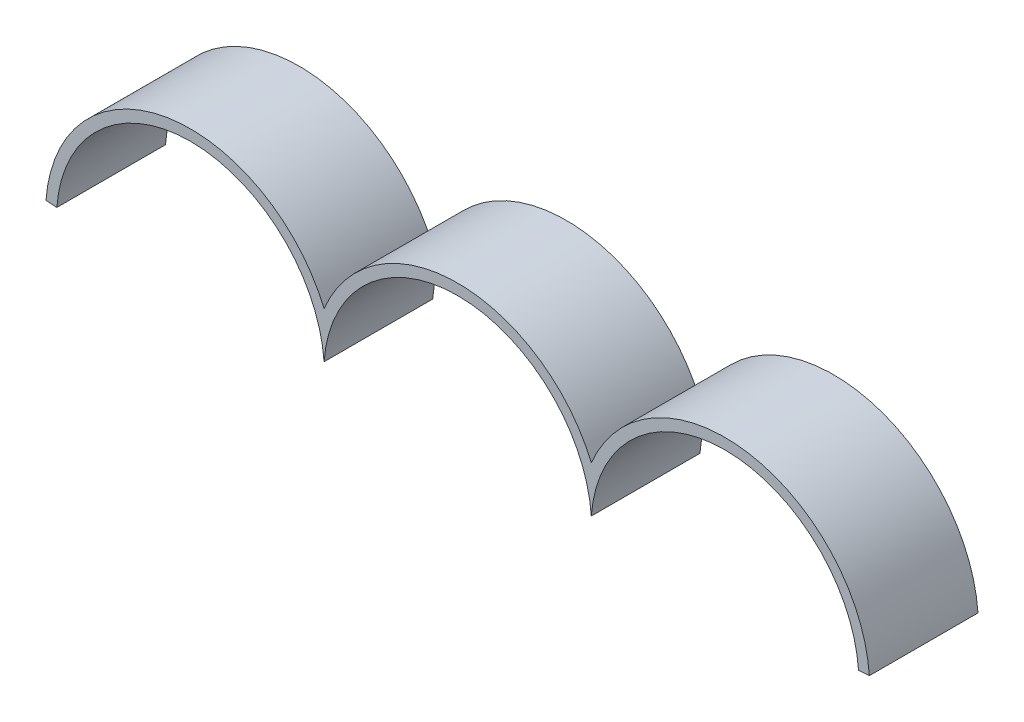
from build123d import *

# Parameters (mm, degrees)
BOSS_EXTRU_1_DEPTH = 30


with BuildPart() as part:
    # Esquisse1 → Boss.-Extru.1 (new body)
    with BuildSketch(Plane.XY):
        with BuildLine():
            Line((-76.791412836, 0.22066851), (-73.799539608, 0))
            ThreePointArc((-73.799539608, 0), (-36.899769804, 34.278421708), (0, 0))
            ThreePointArc((0, 0), (36.899769804, 34.278421708), (73.799539608, 0))
            ThreePointArc((73.799539608, 0), (110.699309413, 34.278421708), (147.599079217, 0))
            Line((147.599079217, 0), (150.590952444, 0.22066851))
            ThreePointArc((150.590952444, 0.22066851), (117.124960694, 36.75893596), (73.799539608, 12.718855264))
            ThreePointArc((73.799539608, 12.718855264), (36.899769804, 37.278421708), (0, 12.718855264))
            ThreePointArc((0, 12.718855264), (-43.325421085, 36.75893596), (-76.791412836, 0.22066851))
        make_face()
    extrude(amount=BOSS_EXTRU_1_DEPTH)


solid = part.part
